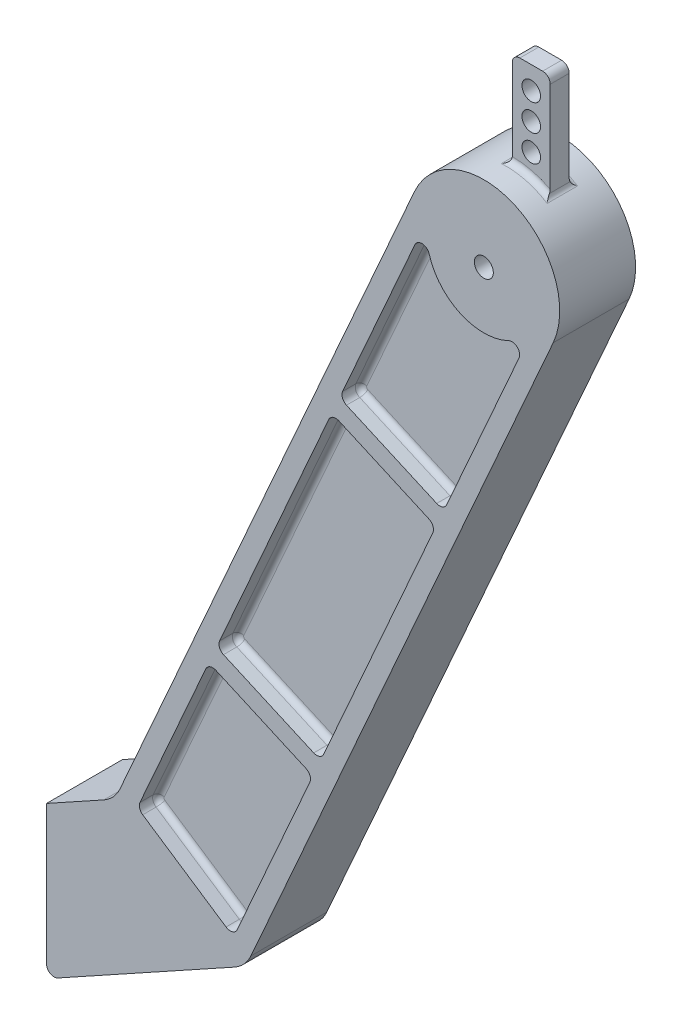
from build123d import *

# Parameters (mm, degrees)
SKETCH1_R           = 3.175
BOSS_EXTRUDE1_DEPTH = 12.7
CUT_EXTRUDE1_DEPTH  = 6.35
SKETCH3_R           = 3.1115
BOSS_EXTRUDE2_DEPTH = 3.175
FILLET1_R           = 1.905
FILLET2_R           = 1.905


with BuildPart() as part:
    # Sketch1 → Boss-Extrude1 (new, symmetric)
    with BuildSketch(Plane.XY):
        with BuildLine():
            Line((-23.221886801, 10.290965621), (-121.74805685, -212.036428324))
            ThreePointArc((-121.74805685, -212.036428324), (-123.991527417, -215.466518539), (-127.210639188, -218.003445513))
            Line((-127.210639188, -218.003445513), (-146.362769413, -228.6))
            Line((-146.362769413, -228.6), (-146.362769413, -275.091803186))
            ThreePointArc((-146.362769413, -275.091803186), (-145.112775727, -277.279835112), (-142.593097201, -277.314303186))
            Line((-142.593097201, -277.314303186), (-83.42150114, -244.57564517))
            ThreePointArc((-83.42150114, -244.57564517), (-80.202389369, -242.038718195), (-77.958918802, -238.60862798))
            Line((-77.958918802, -238.60862798), (23.221886801, -10.290965621))
            ThreePointArc((23.221886801, -10.290965621), (10.290965621, 23.221886801), (-23.221886801, 10.290965621))
        make_face()
        Circle(SKETCH1_R, mode=Mode.SUBTRACT)
    extrude(amount=BOSS_EXTRUDE1_DEPTH, both=True)

    # Sketch2 → Cut-Extrude1 (cut)
    with BuildSketch(Plane.XY.offset(12.7)):
        with BuildLine():
            Line((-87.13098577, -155.86407995), (-56.942532929, -169.242335258))
            ThreePointArc((-56.942532929, -169.242335258), (-54.999082162, -169.289863098), (-53.591247687, -167.94924314))
            Line((-53.591247687, -167.94924314), (-17.058319731, -85.511544998))
            ThreePointArc((-17.058319731, -85.511544998), (-17.010791891, -83.568094231), (-18.351411849, -82.160259756))
            Line((-18.351411849, -82.160259756), (-48.53986469, -68.782004448))
            ThreePointArc((-48.53986469, -68.782004448), (-50.483315457, -68.734476608), (-51.891149932, -70.075096566))
            Line((-51.891149932, -70.075096566), (-88.424077888, -152.512794708))
            ThreePointArc((-88.424077888, -152.512794708), (-88.471605728, -154.456245476), (-87.13098577, -155.86407995))
        make_face()
        with BuildLine():
            Line((-45.967123284, -62.976532748), (-15.778670444, -76.354788056))
            ThreePointArc((-15.778670444, -76.354788056), (-13.835219676, -76.402315896), (-12.427385202, -75.061695938))
            Line((-12.427385202, -75.061695938), (11.779821091, -20.437375445))
            ThreePointArc((11.779821091, -20.437375445), (11.220804455, -17.579939651), (8.344969774, -17.124951955))
            ThreePointArc((8.344969774, -17.124951955), (-7.718224216, -17.4164151), (-18.291900379, -5.320609036))
            ThreePointArc((-18.291900379, -5.320609036), (-20.560656678, -3.495729926), (-23.05300911, -5.000927012))
            Line((-23.05300911, -5.000927012), (-47.260215402, -59.625247506))
            ThreePointArc((-47.260215402, -59.625247506), (-47.307743243, -61.568698273), (-45.967123284, -62.976532748))
        make_face()
        with BuildLine():
            Line((-89.703727175, -161.66955165), (-59.515274334, -175.047806958))
            ThreePointArc((-59.515274334, -175.047806958), (-58.174654376, -176.455641433), (-58.222182217, -178.3990922))
            Line((-58.222182217, -178.3990922), (-82.543211689, -233.280258269))
            ThreePointArc((-82.543211689, -233.280258269), (-84.155903931, -234.690057934), (-86.273182721, -234.365339762))
            Line((-86.273182721, -234.365339762), (-114.160951416, -215.795518496))
            ThreePointArc((-114.160951416, -215.795518496), (-115.192065291, -214.390836879), (-115.075357744, -212.652243879))
            Line((-115.075357744, -212.652243879), (-93.055012417, -162.962643768))
            ThreePointArc((-93.055012417, -162.962643768), (-91.647177943, -161.62202381), (-89.703727175, -161.66955165))
        make_face()
    cut_extrude1 = extrude(amount=-CUT_EXTRUDE1_DEPTH, mode=Mode.SUBTRACT)

    # Mirror1: Cut-Extrude1 across plane
    add(cut_extrude1.mirror(Plane.XY), mode=Mode.SUBTRACT)

    # Sketch3 → Boss-Extrude2 (add, symmetric)
    with BuildSketch(Plane.XY):
        with BuildLine():
            Line((0, 25.4), (0, 54.61))
            ThreePointArc((0, 54.61), (0.743948776, 56.406051224), (2.54, 57.15))
            Line((2.54, 57.15), (10.16, 57.15))
            ThreePointArc((10.16, 57.15), (11.956051224, 56.406051224), (12.7, 54.61))
            Line((12.7, 54.61), (12.7, 21.997045256))
            ThreePointArc((12.7, 21.997045256), (6.574003746, 24.534515988), (0, 25.4))
        make_face()
        with Locations((6.35, 49.53)):
            Circle(SKETCH3_R, mode=Mode.SUBTRACT)
        with Locations((6.35, 40.64)):
            Circle(SKETCH3_R, mode=Mode.SUBTRACT)
        with Locations((6.35, 31.75)):
            Circle(SKETCH3_R, mode=Mode.SUBTRACT)
    extrude(amount=BOSS_EXTRUDE2_DEPTH, both=True)

    # Fillet1
    fillet1_edges = [part.edges().sort_by_distance(p)[0] for p in [
        (6.574003746, 24.534515988, 3.175),
        (6.574003746, 24.534515988, -3.175),
        (0, 25.4, 0),
        (12.7, 21.997045256, 0),
    ]]
    fillet(fillet1_edges, radius=FILLET1_R)

    # Fillet2
    fillet2_edges = [part.edges().sort_by_distance(p)[0] for p in [
        (11.220804455, -17.579939651, -6.35),
        (-7.718224216, -17.4164151, -6.35),
        (-20.560656678, -3.495729926, -6.35),
        (-35.156612256, -32.313087259, -6.35),
        (-47.307743243, -61.568698273, -6.35),
        (-30.872896864, -69.665660402, -6.35),
        (-13.835219676, -76.402315896, -6.35),
        (-0.323782055, -47.749535691, -6.35),
        (-50.483315457, -68.734476608, -6.35),
        (-70.15761391, -111.293945637, -6.35),
        (-88.471605728, -154.456245476, -6.35),
        (-72.03675935, -162.553207604, -6.35),
        (-54.999082162, -169.289863098, -6.35),
        (-35.324783709, -126.730394069, -6.35),
        (-17.010791891, -83.568094231, -6.35),
        (-33.445638269, -75.471132102, -6.35),
        (-115.192065291, -214.390836879, -6.35),
        (-100.217067068, -225.080429129, -6.35),
        (-84.155903931, -234.690057934, -6.35),
        (-70.382696953, -205.839675235, -6.35),
        (-58.174654376, -176.455641433, -6.35),
        (-74.609500755, -168.358679304, -6.35),
        (-91.647177943, -161.62202381, -6.35),
        (-104.065185081, -187.807443824, -6.35),
        (11.220804455, -17.579939651, 6.35),
        (-0.323782055, -47.749535691, 6.35),
        (-13.835219676, -76.402315896, 6.35),
        (-30.872896864, -69.665660402, 6.35),
        (-47.307743243, -61.568698273, 6.35),
        (-35.156612256, -32.313087259, 6.35),
        (-20.560656678, -3.495729926, 6.35),
        (-7.718224216, -17.4164151, 6.35),
        (-50.483315457, -68.734476608, 6.35),
        (-33.445638269, -75.471132102, 6.35),
        (-17.010791891, -83.568094231, 6.35),
        (-35.324783709, -126.730394069, 6.35),
        (-54.999082162, -169.289863098, 6.35),
        (-72.03675935, -162.553207604, 6.35),
        (-88.471605728, -154.456245476, 6.35),
        (-70.15761391, -111.293945637, 6.35),
        (-115.192065291, -214.390836879, 6.35),
        (-104.065185081, -187.807443824, 6.35),
        (-91.647177943, -161.62202381, 6.35),
        (-74.609500755, -168.358679304, 6.35),
        (-58.174654376, -176.455641433, 6.35),
        (-70.382696953, -205.839675235, 6.35),
        (-84.155903931, -234.690057934, 6.35),
        (-100.217067068, -225.080429129, 6.35),
    ]]
    fillet(fillet2_edges, radius=FILLET2_R)


solid = part.part
